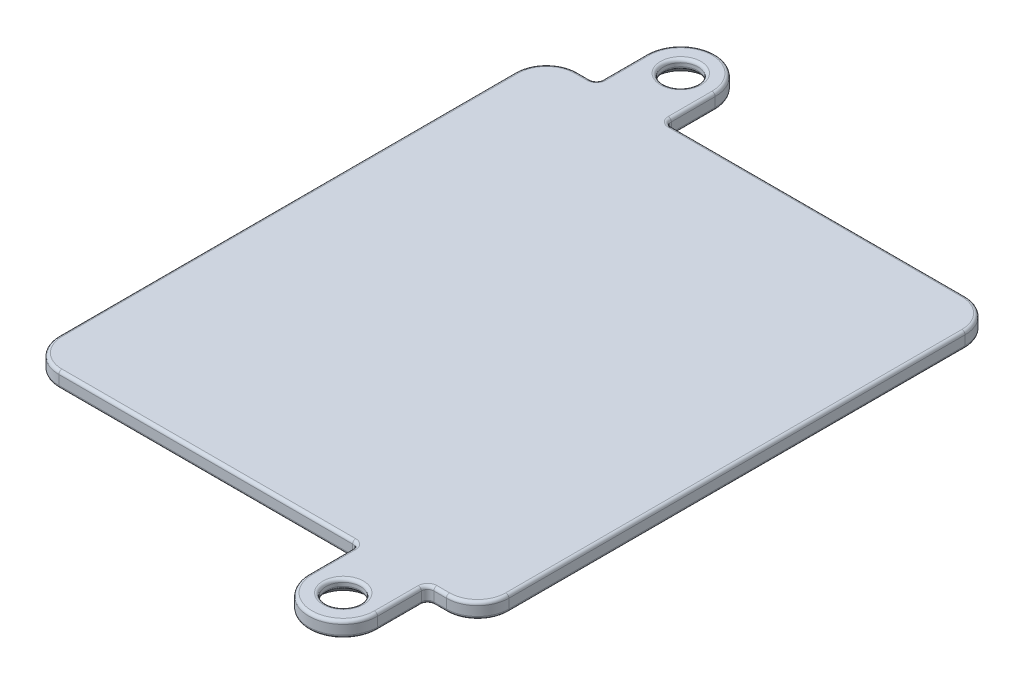
from build123d import *

# Parameters (mm, degrees)
BOSS_EXTRUDE1_DEPTH      = 1.25
BOSS_EXTRUDE1_DEPTH_BACK = 1.25
CUT_EXTRUDE1_REACH       = 67.782
SKETCH2_R                = 2.75
CHAMFER1_SIZE            = 1.25
FILLET1_R                = 0.5


with BuildPart() as part:
    # Sketch1 → Boss-Extrude1 (new, two sides: drawn at the far end of the back side and taken through both)
    with BuildSketch(Plane(origin=(0, 0, 0), x_dir=(1, 0, 0), z_dir=(0, 1, 0)).offset(-BOSS_EXTRUDE1_DEPTH_BACK)):
        with BuildLine():
            Line((36, -36.5), (36, 36.5))
            ThreePointArc((36, 36.5), (34.535533906, 40.035533906), (31, 41.5))
            Line((31, 41.5), (-16, 41.5))
            ThreePointArc((-16, 41.5), (-16.707106781, 41.792893219), (-17, 42.5))
            Line((-17, 42.5), (-17, 49.5))
            ThreePointArc((-17, 49.5), (-22.5, 55), (-28, 49.5))
            Line((-28, 49.5), (-28, 42.5))
            ThreePointArc((-28, 42.5), (-28.292893219, 41.792893219), (-29, 41.5))
            Line((-29, 41.5), (-31, 41.5))
            ThreePointArc((-31, 41.5), (-34.535533906, 40.035533906), (-36, 36.5))
            Line((-36, 36.5), (-36, -36.5))
            ThreePointArc((-36, -36.5), (-34.535533906, -40.035533906), (-31, -41.5))
            Line((-31, -41.5), (16, -41.5))
            ThreePointArc((16, -41.5), (16.707106781, -41.792893219), (17, -42.5))
            Line((17, -42.5), (17, -49.5))
            ThreePointArc((17, -49.5), (22.5, -55), (28, -49.5))
            Line((28, -49.5), (28, -42.5))
            ThreePointArc((28, -42.5), (28.292893219, -41.792893219), (29, -41.5))
            Line((29, -41.5), (31, -41.5))
            ThreePointArc((31, -41.5), (34.535533906, -40.035533906), (36, -36.5))
        make_face()
    extrude(amount=BOSS_EXTRUDE1_DEPTH + BOSS_EXTRUDE1_DEPTH_BACK)

    # Sketch2 → Cut-Extrude1 (cut, up to next)
    with BuildSketch(Plane(origin=(0, 1.25, 0), x_dir=(1, 0, 0), z_dir=(0, 1, 0)), mode=Mode.PRIVATE) as cut_extrude1_sk1:
        with Locations((22.5, -49.5)):
            Circle(SKETCH2_R)
    cut_extrude1_tool1 = extrude(cut_extrude1_sk1.sketch, amount=-CUT_EXTRUDE1_REACH, mode=Mode.PRIVATE) & part.part
    # Sketch2 → Cut-Extrude1 (cut, up to next)
    with BuildSketch(Plane(origin=(0, 1.25, 0), x_dir=(1, 0, 0), z_dir=(0, 1, 0)), mode=Mode.PRIVATE) as cut_extrude1_sk2:
        with Locations((-22.5, 49.5)):
            Circle(SKETCH2_R)
    cut_extrude1_tool2 = extrude(cut_extrude1_sk2.sketch, amount=-CUT_EXTRUDE1_REACH, mode=Mode.PRIVATE) & part.part
    add(cut_extrude1_tool1.solids().sort_by_distance((22.5, 1.25, 49.5))[0], mode=Mode.SUBTRACT)
    add(cut_extrude1_tool2.solids().sort_by_distance((-22.5, 1.25, -49.5))[0], mode=Mode.SUBTRACT)

    # Chamfer1
    chamfer1_edges = [part.edges().sort_by_distance(p)[0] for p in [
        (19.75, -1.25, 49.5),
        (-25.25, -1.25, -49.5),
    ]]
    chamfer(chamfer1_edges, length=CHAMFER1_SIZE)

    # Fillet1
    fillet1_edges = [part.edges().sort_by_distance(p)[0] for p in [
        (-34.535533906, -1.25, -40.035533906),
        (-30, -1.25, -41.5),
        (-28.292893219, -1.25, -41.792893219),
        (-28, -1.25, -46),
        (-22.5, -1.25, -55),
        (-17, -1.25, -46),
        (-16.707106781, -1.25, -41.792893219),
        (7.5, -1.25, -41.5),
        (34.535533906, -1.25, -40.035533906),
        (36, -1.25, 0),
        (34.535533906, -1.25, 40.035533906),
        (30, -1.25, 41.5),
        (28.292893219, -1.25, 41.792893219),
        (28, -1.25, 46),
        (22.5, -1.25, 55),
        (17, -1.25, 46),
        (16.707106781, -1.25, 41.792893219),
        (-7.5, -1.25, 41.5),
        (-34.535533906, -1.25, 40.035533906),
        (-34.535533906, 1.25, -40.035533906),
        (-30, 1.25, -41.5),
        (-28.292893219, 1.25, -41.792893219),
        (-28, 1.25, -46),
        (-22.5, 1.25, -55),
        (-17, 1.25, -46),
        (-16.707106781, 1.25, -41.792893219),
        (7.5, 1.25, -41.5),
        (34.535533906, 1.25, -40.035533906),
        (36, 1.25, 0),
        (34.535533906, 1.25, 40.035533906),
        (30, 1.25, 41.5),
        (28.292893219, 1.25, 41.792893219),
        (28, 1.25, 46),
        (22.5, 1.25, 55),
        (17, 1.25, 46),
        (16.707106781, 1.25, 41.792893219),
        (-7.5, 1.25, 41.5),
        (-34.535533906, 1.25, 40.035533906),
        (-36, -1.25, 0),
        (-36, 1.25, 0),
        (19.75, 1.25, 49.5),
        (19.75, 0, 49.5),
        (-25.25, 1.25, -49.5),
        (-25.25, 0, -49.5),
    ]]
    fillet(fillet1_edges, radius=FILLET1_R)


solid = part.part
